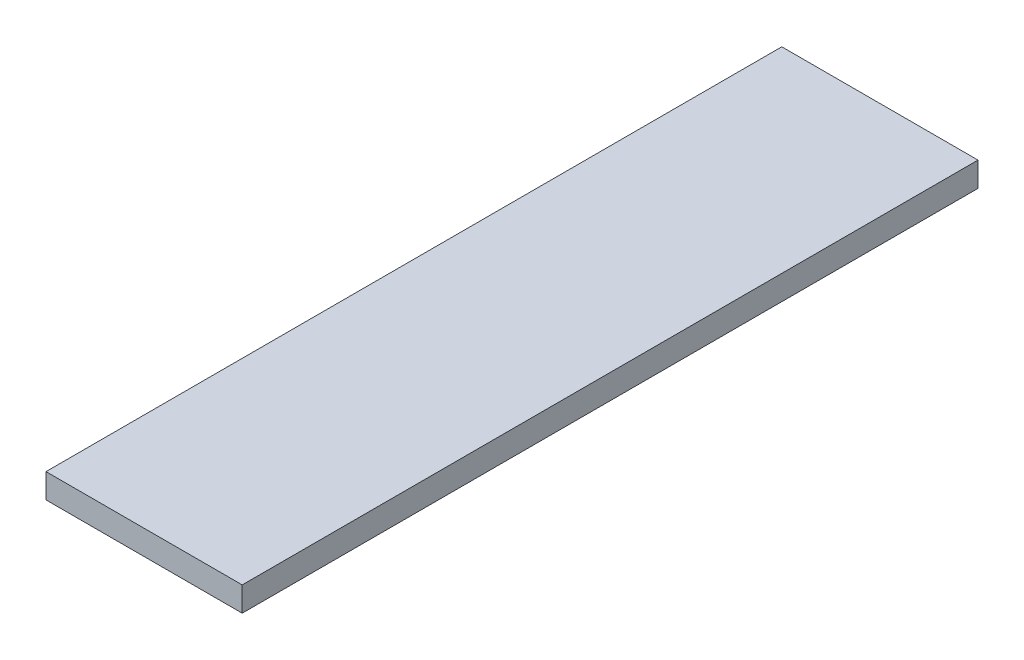
from build123d import *

# Parameters (mm, degrees)
SKETCH1_W           = 25.4
SKETCH1_H           = 6.35
BOSS_EXTRUDE1_DEPTH = 190.5


with BuildPart() as part:
    # Sketch1 → Boss-Extrude1 (new body)
    with BuildSketch(Plane.XY):
        with Locations((12.7, 3.175)):
            Rectangle(SKETCH1_W, SKETCH1_H)
    extrude(amount=BOSS_EXTRUDE1_DEPTH)

    # Mirror1: part across plane


with BuildPart() as part_1:
    add(part.part)
    add(part.part.mirror(Plane(origin=(25.4, 0, 190.5), x_dir=(0, 0, 1), z_dir=(-1, 0, 0))))


solid = part_1.part
